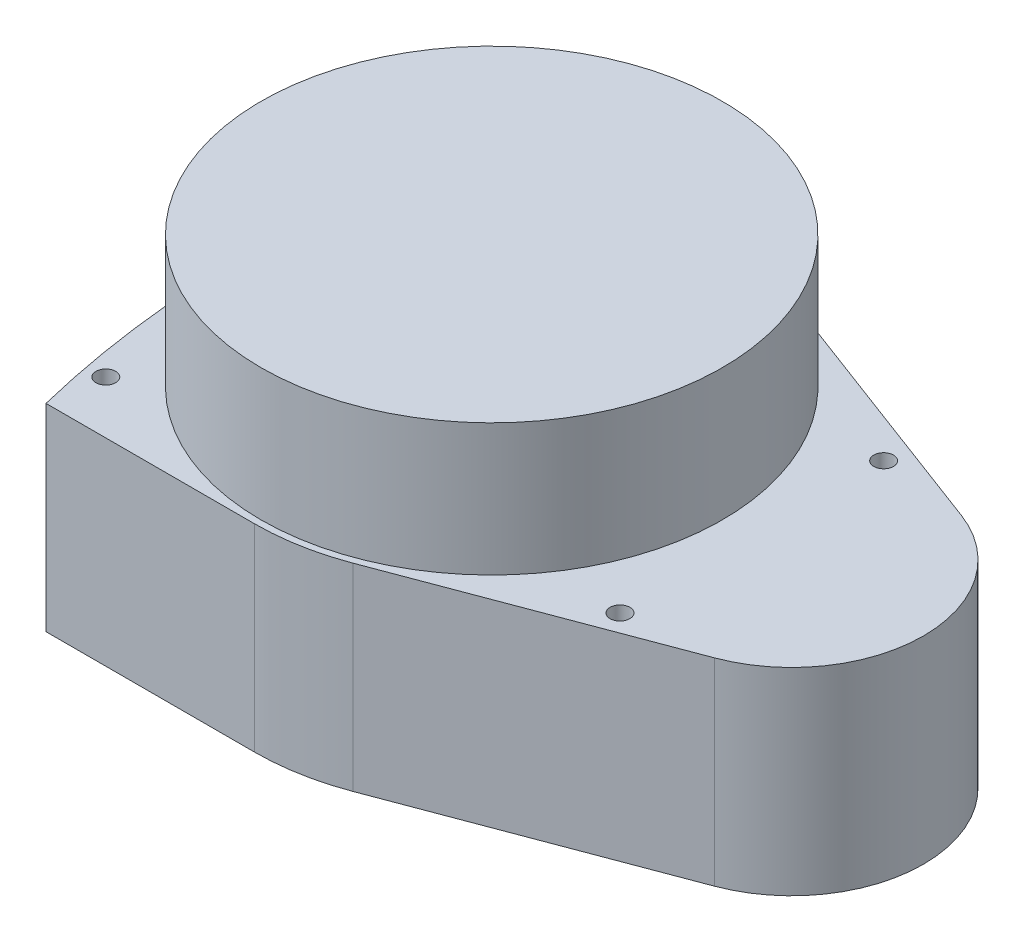
from build123d import *

# Parameters (mm, degrees)
SKETCH_1_R          = 35
EXTRUDE_1_DEPTH     = 20
EXTRUDE_2_DEPTH     = 30
SKETCH_4_R          = 1.5
CUT_EXTRUDE_1_DEPTH = 81.537258458


with BuildPart() as part:
    # 草图1 → 凸台-拉伸1 (new body)
    with BuildSketch(Plane(origin=(0, 0, 0), x_dir=(1, 0, 0), z_dir=(0, 1, 0))):
        with Locations(Location((0, 0, 0), (0, 0, 270))):
            Circle(SKETCH_1_R)
    extrude(amount=EXTRUDE_1_DEPTH)

    # 草图2 → 凸台-拉伸2 (add)
    with BuildSketch(Plane(origin=(0, 0, 0), x_dir=(1, 0, 0), z_dir=(0, 1, 0))):
        with BuildLine():
            Line((52.532967033, 18.722643369), (12.659340659, 33.700758064))
            ThreePointArc((12.659340659, 33.700758064), (6.433222742, 35.42052576), (0, 36))
            Line((0, 36), (-31.615933194, 36))
            ThreePointArc((-31.615933194, 36), (-34.899949596, 18.132981289), (-36, 0))
            Line((-36, 0), (65.5, 0))
            ThreePointArc((65.5, 0), (61.941705214, 11.387288074), (52.532967033, 18.722643369))
        make_face()
    extrude_2 = extrude(amount=-EXTRUDE_2_DEPTH)

    # 镜向1: 凸台-拉伸2 across plane
    add(extrude_2.mirror(Plane(origin=(-36, -30, 0), x_dir=(1, 0, 0), z_dir=(0, 0, 1))))

    # 草图4 → 切除-拉伸1 (cut, through all)
    with BuildSketch(Plane(origin=(0, 0, 0), x_dir=(1, 0, 0), z_dir=(0, 1, 0))):
        with Locations(Location((-30.54, 28, 0), (0, 0, 270))):
            Circle(SKETCH_4_R)
        with Locations(Location((39.46, 20, 0), (0, 0, 270))):
            Circle(SKETCH_4_R)
    cut_extrude_1 = extrude(amount=-CUT_EXTRUDE_1_DEPTH, mode=Mode.SUBTRACT)

    # 镜向2: 切除-拉伸1 across plane
    add(cut_extrude_1.mirror(Plane.XY), mode=Mode.SUBTRACT)


solid = part.part
